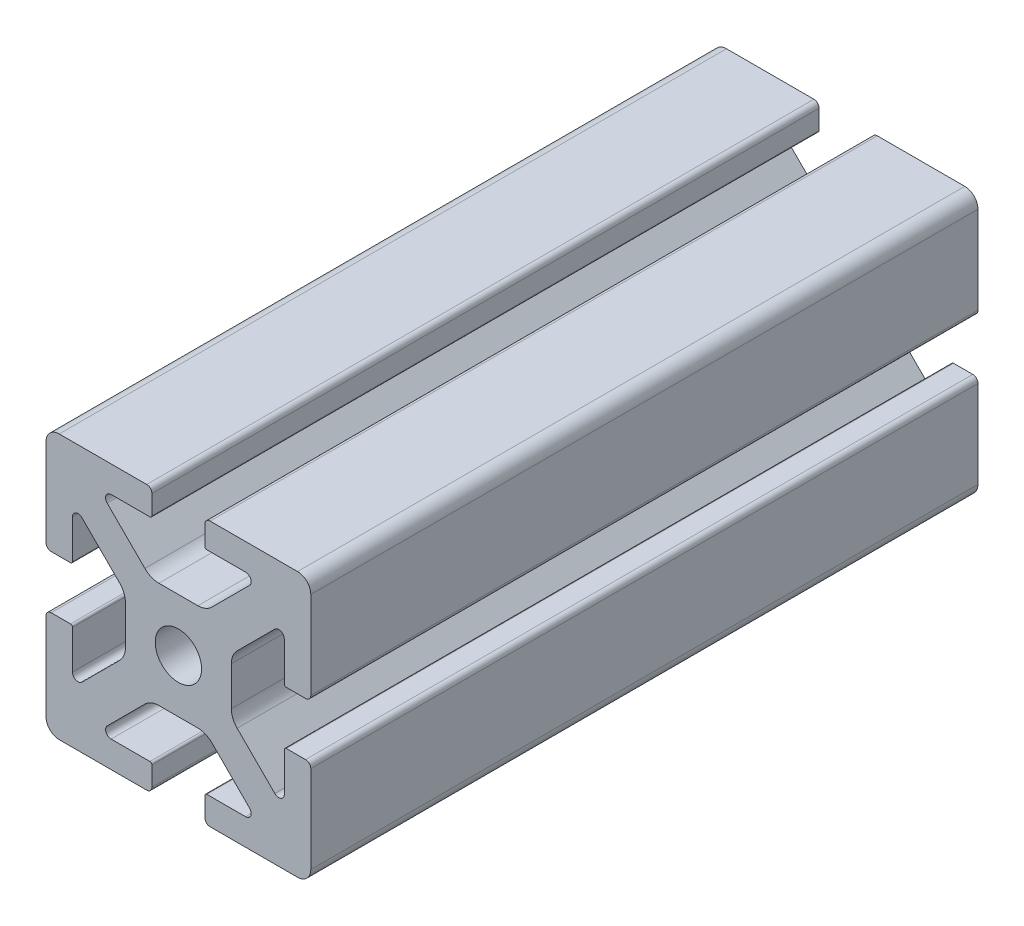
from build123d import *

# Parameters (mm, degrees)
BOSS_EXTRUDE1_DEPTH      = 50.4
BOSS_EXTRUDE1_DEPTH_BACK = 50.4
SKETCH3_R                = 3.5


with BuildPart() as part:
    # Sketch3 → Boss-Extrude1 (new, two sides: drawn at the far end of the back side and taken through both)
    with BuildSketch(Plane.XY.offset(-BOSS_EXTRUDE1_DEPTH_BACK)):
        with BuildLine():
            Line((4.7874, 20), (18, 20))
            ThreePointArc((18, 20), (19.414213562, 19.414213562), (20, 18))
            Line((20, 18), (20, 4.7874))
            ThreePointArc((20, 4.7874), (19.76937588, 4.23062412), (19.2126, 4))
            Line((19.2126, 4), (16.3048, 4))
            ThreePointArc((16.3048, 4), (16.089273853, 4.089273853), (16, 4.3048))
            Line((16, 4.3048), (16, 10.1618))
            ThreePointArc((16, 10.1618), (15.482565253, 10.936195824), (14.569103096, 10.754496904))
            Line((14.569103096, 10.754496904), (8.878679656, 5.064073464))
            ThreePointArc((8.878679656, 5.064073464), (8.228361402, 4.090803418), (8, 2.942753121))
            Line((8, 2.942753121), (8, -2.942753121))
            ThreePointArc((8, -2.942753121), (8.228361402, -4.090803418), (8.878679656, -5.064073464))
            Line((8.878679656, -5.064073464), (14.569103096, -10.754496904))
            ThreePointArc((14.569103096, -10.754496904), (15.482565253, -10.936195824), (16, -10.1618))
            Line((16, -10.1618), (16, -4.3048))
            ThreePointArc((16, -4.3048), (16.089273853, -4.089273853), (16.3048, -4))
            Line((16.3048, -4), (19.2126, -4))
            ThreePointArc((19.2126, -4), (19.76937588, -4.23062412), (20, -4.7874))
            Line((20, -4.7874), (20, -18))
            ThreePointArc((20, -18), (19.414213562, -19.414213562), (18, -20))
            Line((18, -20), (4.7874, -20))
            ThreePointArc((4.7874, -20), (4.23062412, -19.76937588), (4, -19.2126))
            Line((4, -19.2126), (4, -16.3048))
            ThreePointArc((4, -16.3048), (4.089273853, -16.089273853), (4.3048, -16))
            Line((4.3048, -16), (10.1618, -16))
            ThreePointArc((10.1618, -16), (10.936195824, -15.482565253), (10.754496904, -14.569103096))
            Line((10.754496904, -14.569103096), (5.064073464, -8.878679656))
            ThreePointArc((5.064073464, -8.878679656), (4.090803418, -8.228361402), (2.942753121, -8))
            Line((2.942753121, -8), (-2.942753121, -8))
            ThreePointArc((-2.942753121, -8), (-4.090803418, -8.228361402), (-5.064073464, -8.878679656))
            Line((-5.064073464, -8.878679656), (-10.754496904, -14.569103096))
            ThreePointArc((-10.754496904, -14.569103096), (-10.936195824, -15.482565253), (-10.1618, -16))
            Line((-10.1618, -16), (-4.3048, -16))
            ThreePointArc((-4.3048, -16), (-4.089273853, -16.089273853), (-4, -16.3048))
            Line((-4, -16.3048), (-4, -19.2126))
            ThreePointArc((-4, -19.2126), (-4.23062412, -19.76937588), (-4.7874, -20))
            Line((-4.7874, -20), (-18, -20))
            ThreePointArc((-18, -20), (-19.414213562, -19.414213562), (-20, -18))
            Line((-20, -18), (-20, -4.7874))
            ThreePointArc((-20, -4.7874), (-19.76937588, -4.23062412), (-19.2126, -4))
            Line((-19.2126, -4), (-16.3048, -4))
            ThreePointArc((-16.3048, -4), (-16.089273853, -4.089273853), (-16, -4.3048))
            Line((-16, -4.3048), (-16, -10.1618))
            ThreePointArc((-16, -10.1618), (-15.482565253, -10.936195824), (-14.569103096, -10.754496904))
            Line((-14.569103096, -10.754496904), (-8.878679656, -5.064073464))
            ThreePointArc((-8.878679656, -5.064073464), (-8.228361402, -4.090803418), (-8, -2.942753121))
            Line((-8, -2.942753121), (-8, 2.942753121))
            ThreePointArc((-8, 2.942753121), (-8.228361402, 4.090803418), (-8.878679656, 5.064073464))
            Line((-8.878679656, 5.064073464), (-14.569103096, 10.754496904))
            ThreePointArc((-14.569103096, 10.754496904), (-15.482565253, 10.936195824), (-16, 10.1618))
            Line((-16, 10.1618), (-16, 4.3048))
            ThreePointArc((-16, 4.3048), (-16.089273853, 4.089273853), (-16.3048, 4))
            Line((-16.3048, 4), (-19.2126, 4))
            ThreePointArc((-19.2126, 4), (-19.76937588, 4.23062412), (-20, 4.7874))
            Line((-20, 4.7874), (-20, 18))
            ThreePointArc((-20, 18), (-19.414213562, 19.414213562), (-18, 20))
            Line((-18, 20), (-4.7874, 20))
            ThreePointArc((-4.7874, 20), (-4.23062412, 19.76937588), (-4, 19.2126))
            Line((-4, 19.2126), (-4, 16.3048))
            ThreePointArc((-4, 16.3048), (-4.089273853, 16.089273853), (-4.3048, 16))
            Line((-4.3048, 16), (-10.1618, 16))
            ThreePointArc((-10.1618, 16), (-10.936195824, 15.482565253), (-10.754496904, 14.569103096))
            Line((-10.754496904, 14.569103096), (-5.064073464, 8.878679656))
            ThreePointArc((-5.064073464, 8.878679656), (-4.090803418, 8.228361402), (-2.942753121, 8))
            Line((-2.942753121, 8), (2.942753121, 8))
            ThreePointArc((2.942753121, 8), (4.090803418, 8.228361402), (5.064073464, 8.878679656))
            Line((5.064073464, 8.878679656), (10.754496904, 14.569103096))
            ThreePointArc((10.754496904, 14.569103096), (10.936195824, 15.482565253), (10.1618, 16))
            Line((10.1618, 16), (4.3048, 16))
            ThreePointArc((4.3048, 16), (4.089273853, 16.089273853), (4, 16.3048))
            Line((4, 16.3048), (4, 19.2126))
            ThreePointArc((4, 19.2126), (4.23062412, 19.76937588), (4.7874, 20))
        make_face()
        Circle(SKETCH3_R, mode=Mode.SUBTRACT)
    extrude(amount=BOSS_EXTRUDE1_DEPTH + BOSS_EXTRUDE1_DEPTH_BACK)


solid = part.part
